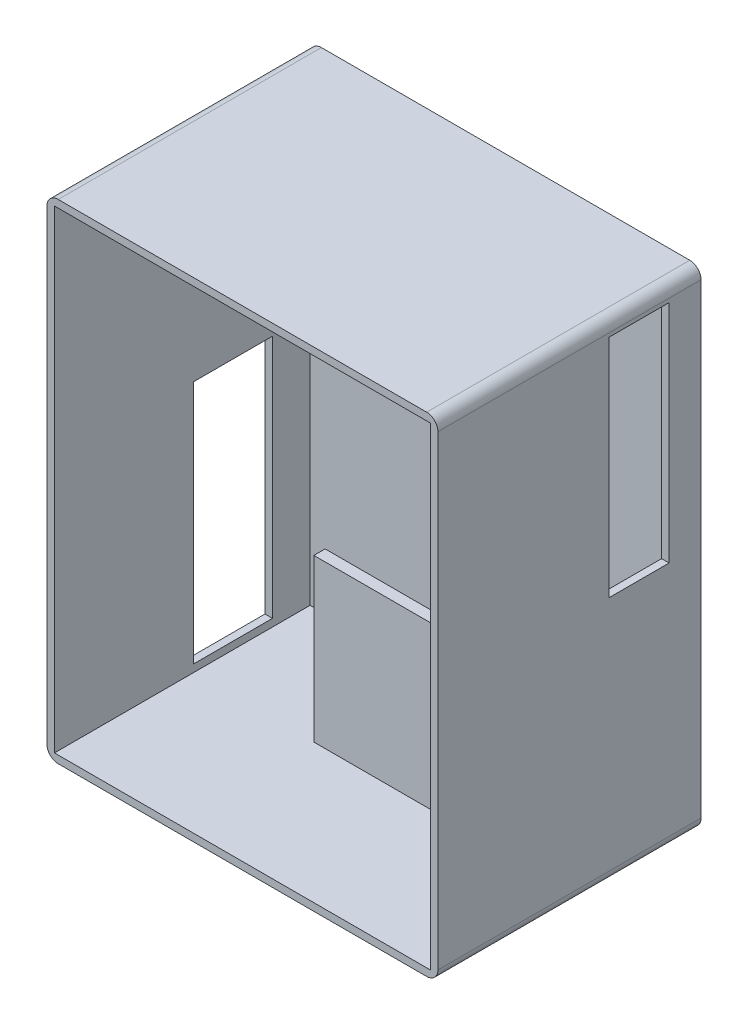
from build123d import *

# Parameters (mm, degrees)
SKETCH_1_W          = 104
SKETCH_1_H          = 130
EXTRUDE_1_DEPTH     = 70
SHELL_1_T           = -2
SKETCH_4_W          = 21
SKETCH_4_H          = 65
CUT_EXTRUDE_1_DEPTH = 70
SKETCH_6_W          = 16
SKETCH_6_H          = 60
CUT_EXTRUDE_2_DEPTH = 70
SKETCH_13_W         = 3
SKETCH_13_H         = 45
EXTRUDE_5_DEPTH     = 70
FILLET_2_R          = 3


with BuildPart() as part:
    # 草圖1 → 填料-伸長1 (new body)
    with BuildSketch(Plane.XY):
        Rectangle(SKETCH_1_W, SKETCH_1_H)
    extrude(amount=EXTRUDE_1_DEPTH)

    # 薄殼1
    shell_1_openings = [part.faces().sort_by_distance(p)[0] for p in [
        (0, 0, 70),
    ]]
    offset(amount=SHELL_1_T, openings=shell_1_openings, kind=Kind.INTERSECTION)

    # 草圖4 → 除料-伸長1 (cut)
    with BuildSketch(Plane.ZY.offset(52)):
        with Locations((22.5, -28.5)):
            Rectangle(SKETCH_4_W, SKETCH_4_H)
    extrude(amount=-CUT_EXTRUDE_1_DEPTH, mode=Mode.SUBTRACT)

    # 草圖6 → 除料-伸長2 (cut)
    with BuildSketch(Plane(origin=(52, 0, 0), x_dir=(0, 0, -1), z_dir=(1, 0, 0))):
        with Locations((-16.5, 31)):
            Rectangle(SKETCH_6_W, SKETCH_6_H)
    extrude(amount=-CUT_EXTRUDE_2_DEPTH, mode=Mode.SUBTRACT)

    # 草圖13 → 填料-伸長5 (add)
    with BuildSketch(Plane(origin=(52, 0, 0), x_dir=(0, 0, -1), z_dir=(1, 0, 0))):
        with Locations((-31.5, -42.5)):
            Rectangle(SKETCH_13_W, SKETCH_13_H)
    extrude(amount=-EXTRUDE_5_DEPTH)

    # 圓角2
    fillet_2_edges = [part.edges().sort_by_distance(p)[0] for p in [
        (52, -65, 35),
        (-52, -65, 35),
        (-52, 65, 35),
        (52, 65, 35),
    ]]
    fillet(fillet_2_edges, radius=FILLET_2_R)


solid = part.part
